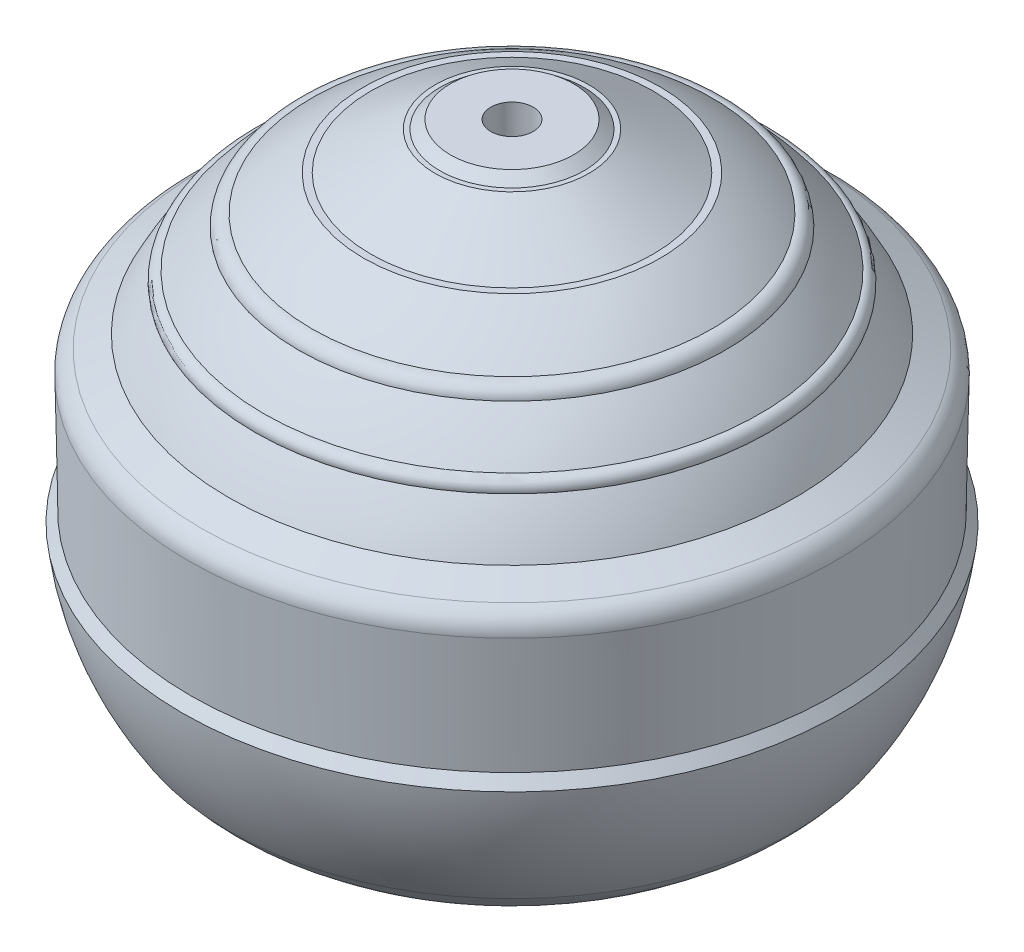
from build123d import *

# Parameters (mm, degrees)
IZIM2_R               = 0.9
KES_EKSTR_ZYON1_DEPTH = 10


with BuildPart() as part:
    # Çizim1 → Döndür1 (revolve)
    with BuildSketch(Plane.XY, mode=Mode.PRIVATE) as d_nd_r1_sk:
        with BuildLine():
            Line((0, 0), (0, -2.033797595))
            Line((0, -2.033797595), (0.9, -2.033797595))
            ThreePointArc((0.9, -2.033797595), (11.039125415, -9.294927197), (9.255545592, -21.637727135))
            Line((9.255545592, -21.637727135), (10.25750189, -21.637727135))
            ThreePointArc((10.25750189, -21.637727135), (11.216781964, -20.984862896), (12.035770488, -20.162848435))
            ThreePointArc((12.035770488, -20.162848435), (13.336250032, -17.622308215), (14, -14.846515061))
            Line((14, -14.846515061), (13.65, -14.381673028))
            Line((13.65, -14.381673028), (13.738757731, -9.380034665))
            ThreePointArc((13.738757731, -9.380034665), (13.592988482, -8.842139112), (13.18196088, -8.465792714))
            Line((13.18196088, -8.465792714), (12.035770488, -7.89935064))
            ThreePointArc((12.035770488, -7.89935064), (11.513052517, -6.958117416), (10.919550231, -6.059836227))
            ThreePointArc((10.919550231, -6.059836227), (10.849987846, -5.720823655), (10.543635929, -5.559836227))
            ThreePointArc((10.543635929, -5.559836227), (9.837206407, -4.731129974), (9.068504463, -3.959836227))
            ThreePointArc((9.068504463, -3.959836227), (8.8868459, -3.592970847), (8.499721613, -3.459836227))
            ThreePointArc((8.499721613, -3.459836227), (7.436594531, -2.657507158), (6.30203453, -1.959836227))
            Line((6.30203453, -1.959836227), (6.00203453, -1.959836227))
            Line((6.00203453, -1.959836227), (3.266196329, -0.359836227))
            Line((3.266196329, -0.359836227), (3.066196329, -0.359836227))
            Line((3.066196329, -0.359836227), (2.616401045, 0))
            Line((2.616401045, 0), (0.9, 0))
            Line((0.9, 0), (0, 0))
        make_face()
    revolve(d_nd_r1_sk.sketch.rotate(Axis((0, 0, 0), (0, -1, 0)), 90), axis=Axis((0, 0, 0), (0, -1, 0)))

    # Çizim2 → Kes-Ekstrüzyon1 (cut)
    with BuildSketch(Plane(origin=(0, 0, 0), x_dir=(1, 0, 0), z_dir=(0, 1, 0))):
        with Locations(Location((0, 0, 0), (0, 0, 270))):
            Circle(IZIM2_R)
    extrude(amount=-KES_EKSTR_ZYON1_DEPTH, mode=Mode.SUBTRACT)


solid = part.part
